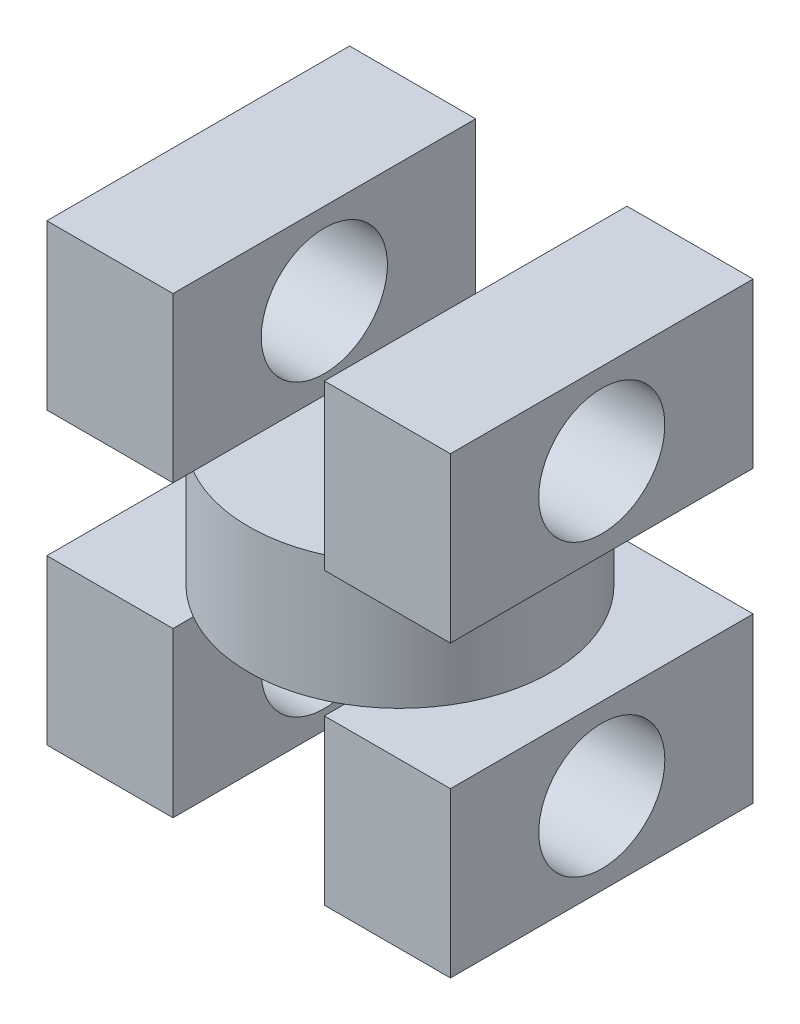
from build123d import *

# Parameters (mm, degrees)
SKETCH1_W           = 32
SKETCH1_H           = 13
BOSS_EXTRUDE1_DEPTH = 24
SKETCH2_W           = 12
SKETCH2_H           = 13
CUT_EXTRUDE1_DEPTH  = 43.05948169
SKETCH3_R           = 4.5
CUT_EXTRUDE2_DEPTH  = 43.05948169
SKETCH4_R           = 12
BOSS_EXTRUDE2_DEPTH = 10
SKETCH5_R           = 5
CUT_EXTRUDE3_DEPTH  = 47.14108798
SKETCH6_R           = 5
CUT_EXTRUDE4_DEPTH  = 47.14108798


with BuildPart() as part:
    # Sketch1 → Boss-Extrude1 (new body)
    with BuildSketch(Plane.XY):
        with Locations((-16, 6.5)):
            Rectangle(SKETCH1_W, SKETCH1_H)
    boss_extrude1 = extrude(amount=BOSS_EXTRUDE1_DEPTH)

    # Sketch2 → Cut-Extrude1 (cut, through all)
    with BuildSketch(Plane(origin=(0, 0, 0), x_dir=(-1, 0, 0), z_dir=(0, 0, -1))):
        with Locations((16, 6.5)):
            Rectangle(SKETCH2_W, SKETCH2_H)
    cut_extrude1 = extrude(amount=-CUT_EXTRUDE1_DEPTH, mode=Mode.SUBTRACT)


with BuildPart() as cut_extrude1_piece_1:
    # of the separate pieces the step leaves, piece 1, a body of its own (cut_extrude1_pieces)
    add(part.part.solids().sort_by_distance((0, 0, 0))[0])


with BuildPart() as cut_extrude1_piece_2:
    # of the separate pieces the step leaves, piece 2, a body of its own (cut_extrude1_pieces)
    add(part.part.solids().sort_by_distance((-32, 0, 0))[0])


with BuildPart() as cut_extrude2_tool:
    # Sketch3 → Cut-Extrude2 (new, through all)
    with BuildSketch(Plane(origin=(0, 0, 0), x_dir=(0, 0, -1), z_dir=(1, 0, 0))):
        with Locations((-12, 6.5)):
            Circle(SKETCH3_R)
    cut_extrude2 = extrude(amount=-CUT_EXTRUDE2_DEPTH)


with BuildPart() as cut_extrude1_piece_1_1:
    add(cut_extrude1_piece_1.part)

    # Cut-Extrude2: cut by cut_extrude2_tool
    add(cut_extrude2_tool.part, mode=Mode.SUBTRACT)



with BuildPart() as cut_extrude1_piece_2_1:
    add(cut_extrude1_piece_2.part)

    # Cut-Extrude2: cut by cut_extrude2_tool
    add(cut_extrude2_tool.part, mode=Mode.SUBTRACT)


with BuildPart() as cut_extrude1_piece_1_2:
    add(cut_extrude1_piece_1_1.part)

    add(cut_extrude1_piece_2_1.part)  # Boss-Extrude2 merges Cut-Extrude1 piece 2
    # Sketch4 → Boss-Extrude2 (add)
    with BuildSketch(Plane(origin=(0, 0, 0), x_dir=(-1, 0, 0), z_dir=(0, -1, 0))):
        with Locations(Location((16, -12, 0), (0, 0, 240))):
            Circle(SKETCH4_R)
    extrude(amount=BOSS_EXTRUDE2_DEPTH)

    # Mirror1: Boss-Extrude1, Cut-Extrude1, Cut-Extrude2 across plane
    add(boss_extrude1.mirror(Plane.ZX.offset(-5)))
    add(cut_extrude1.mirror(Plane.ZX.offset(-5)), mode=Mode.SUBTRACT)
    add(cut_extrude2.mirror(Plane.ZX.offset(-5)), mode=Mode.SUBTRACT)

    # Sketch5 → Cut-Extrude3 (cut, through all)
    with BuildSketch(Plane(origin=(0, 0, 0), x_dir=(0, 0, -1), z_dir=(1, 0, 0))):
        with Locations((-12, -16.5)):
            Circle(SKETCH5_R)
    extrude(amount=-CUT_EXTRUDE3_DEPTH, mode=Mode.SUBTRACT)

    # Sketch6 → Cut-Extrude4 (cut, through all)
    with BuildSketch(Plane.ZY.offset(32)):
        with Locations((12, 6.5)):
            Circle(SKETCH6_R)
    extrude(amount=-CUT_EXTRUDE4_DEPTH, mode=Mode.SUBTRACT)


solid = cut_extrude1_piece_1_2.part
